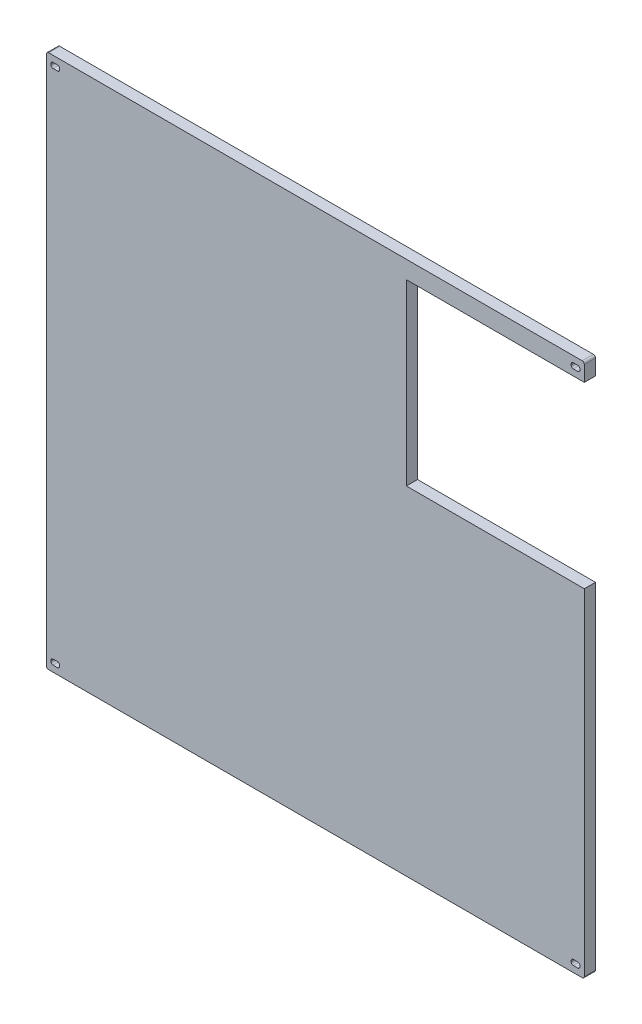
from build123d import *

# Parameters (mm, degrees)
BOSS_EXTRUDE2_DEPTH = 12.7
FILLET2_R           = 2.5


with BuildPart() as part:
    # Sketch1 → Boss-Extrude2 (new body)
    with BuildSketch(Plane.XY):
        Polygon((0, 0), (-611.632, 0), (-611.632, 607.568), (0, 607.568), (0, 587.480907233), (-202.395078438, 587.480907233), (-202.395078438, 384.280907233), (0, 384.280907233), align=None)
        with BuildLine():
            Line((-5, 10.5), (-5, 9.5))
            ThreePointArc((-5, 9.5), (-5.732233047, 7.732233047), (-7.5, 7))
            Line((-7.5, 7), (-12.5, 7))
            ThreePointArc((-12.5, 7), (-14.267766953, 7.732233047), (-15, 9.5))
            Line((-15, 9.5), (-15, 10.5))
            ThreePointArc((-15, 10.5), (-14.267766953, 12.267766953), (-12.5, 13))
            Line((-12.5, 13), (-7.5, 13))
            ThreePointArc((-7.5, 13), (-5.732233047, 12.267766953), (-5, 10.5))
        make_face(mode=Mode.SUBTRACT)
        with BuildLine():
            Line((-596.63, 10.5), (-596.63, 9.5))
            ThreePointArc((-596.63, 9.5), (-597.362233047, 7.732233047), (-599.13, 7))
            Line((-599.13, 7), (-604.13, 7))
            ThreePointArc((-604.13, 7), (-605.897766953, 7.732233047), (-606.63, 9.5))
            Line((-606.63, 9.5), (-606.63, 10.5))
            ThreePointArc((-606.63, 10.5), (-605.897766953, 12.267766953), (-604.13, 13))
            Line((-604.13, 13), (-599.13, 13))
            ThreePointArc((-599.13, 13), (-597.362233047, 12.267766953), (-596.63, 10.5))
        make_face(mode=Mode.SUBTRACT)
        with BuildLine():
            Line((-596.63, 598.07), (-596.63, 597.07))
            ThreePointArc((-596.63, 597.07), (-597.362233047, 595.302233047), (-599.13, 594.57))
            Line((-599.13, 594.57), (-604.13, 594.57))
            ThreePointArc((-604.13, 594.57), (-605.897766953, 595.302233047), (-606.63, 597.07))
            Line((-606.63, 597.07), (-606.63, 598.07))
            ThreePointArc((-606.63, 598.07), (-605.897766953, 599.837766953), (-604.13, 600.57))
            Line((-604.13, 600.57), (-599.13, 600.57))
            ThreePointArc((-599.13, 600.57), (-597.362233047, 599.837766953), (-596.63, 598.07))
        make_face(mode=Mode.SUBTRACT)
        with BuildLine():
            Line((-5, 598.07), (-5, 597.07))
            ThreePointArc((-5, 597.07), (-5.732233047, 595.302233047), (-7.5, 594.57))
            Line((-7.5, 594.57), (-12.5, 594.57))
            ThreePointArc((-12.5, 594.57), (-14.267766953, 595.302233047), (-15, 597.07))
            Line((-15, 597.07), (-15, 598.07))
            ThreePointArc((-15, 598.07), (-14.267766953, 599.837766953), (-12.5, 600.57))
            Line((-12.5, 600.57), (-7.5, 600.57))
            ThreePointArc((-7.5, 600.57), (-5.732233047, 599.837766953), (-5, 598.07))
        make_face(mode=Mode.SUBTRACT)
    extrude(amount=BOSS_EXTRUDE2_DEPTH)

    # Fillet2
    fillet2_edges = [part.edges().sort_by_distance(p)[0] for p in [
        (0, 0, 6.35),
        (-611.632, 0, 6.35),
        (-611.632, 607.568, 6.35),
        (0, 607.568, 6.35),
    ]]
    fillet(fillet2_edges, radius=FILLET2_R)


solid = part.part
